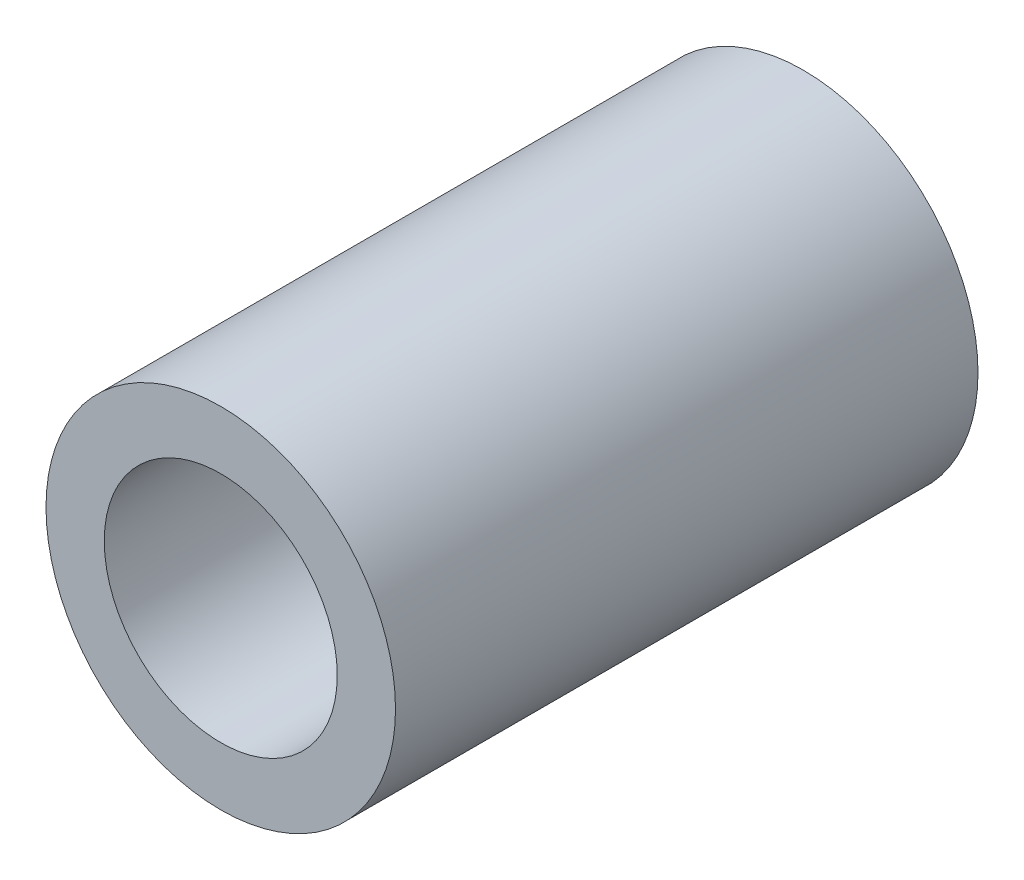
from build123d import *

# Parameters (mm, degrees)
SKETCH1_R           = 15
SKETCH1_R_2         = 10
BOSS_EXTRUDE1_DEPTH = 50


with BuildPart() as part:
    # Sketch1 → Boss-Extrude1 (new body)
    with BuildSketch(Plane.XY):
        Circle(SKETCH1_R)
        Circle(SKETCH1_R_2, mode=Mode.SUBTRACT)
    extrude(amount=BOSS_EXTRUDE1_DEPTH)


solid = part.part
